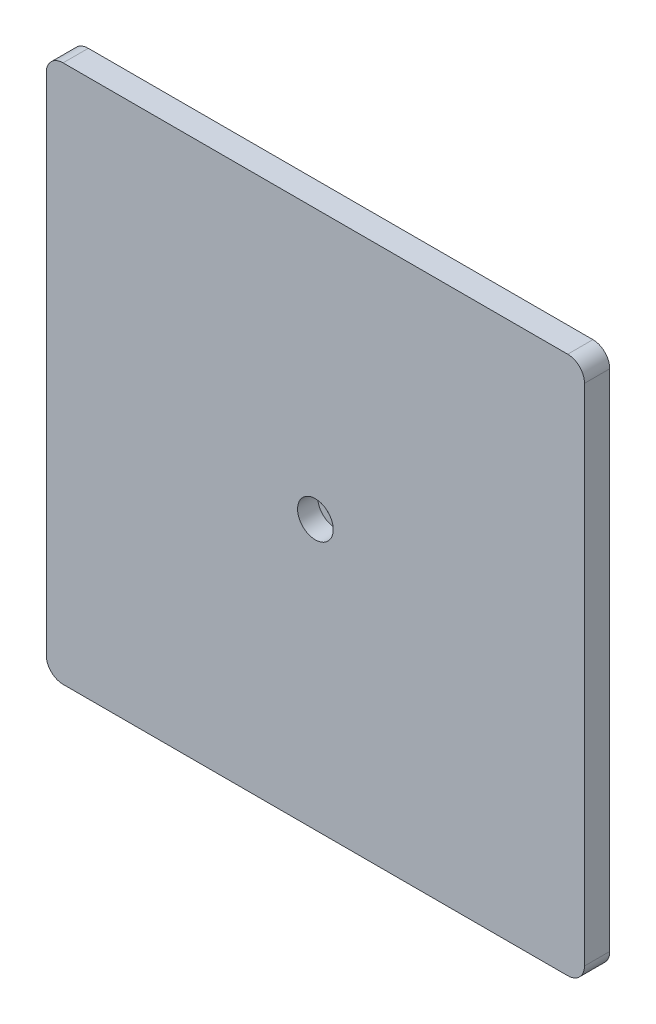
from build123d import *

# Parameters (mm, degrees)
BOSS_EXTRUDE1_DEPTH = 15
SKETCH2_R           = 10.6
CUT_EXTRUDE1_DEPTH  = 12
SKETCH3_R           = 6.5
CUT_EXTRUDE2_DEPTH  = 10


with BuildPart() as part:
    # Sketch1 → Boss-Extrude1 (new body)
    with BuildSketch(Plane.XY):
        with BuildLine():
            Line((-150, 160), (150, 160))
            ThreePointArc((150, 160), (157.071067812, 157.071067812), (160, 150))
            Line((160, 150), (160, -150))
            ThreePointArc((160, -150), (157.071067812, -157.071067812), (150, -160))
            Line((150, -160), (-150, -160))
            ThreePointArc((-150, -160), (-157.071067812, -157.071067812), (-160, -150))
            Line((-160, -150), (-160, 150))
            ThreePointArc((-160, 150), (-157.071067812, 157.071067812), (-150, 160))
        make_face()
    extrude(amount=BOSS_EXTRUDE1_DEPTH)

    # Sketch2 → Cut-Extrude1 (cut)
    with BuildSketch(Plane.XY.offset(15)):
        Circle(SKETCH2_R)
    extrude(amount=-CUT_EXTRUDE1_DEPTH, mode=Mode.SUBTRACT)

    # Sketch3 → Cut-Extrude2 (cut)
    with BuildSketch(Plane.XY.offset(3)):
        Circle(SKETCH3_R)
    extrude(amount=-CUT_EXTRUDE2_DEPTH, mode=Mode.SUBTRACT)


solid = part.part
